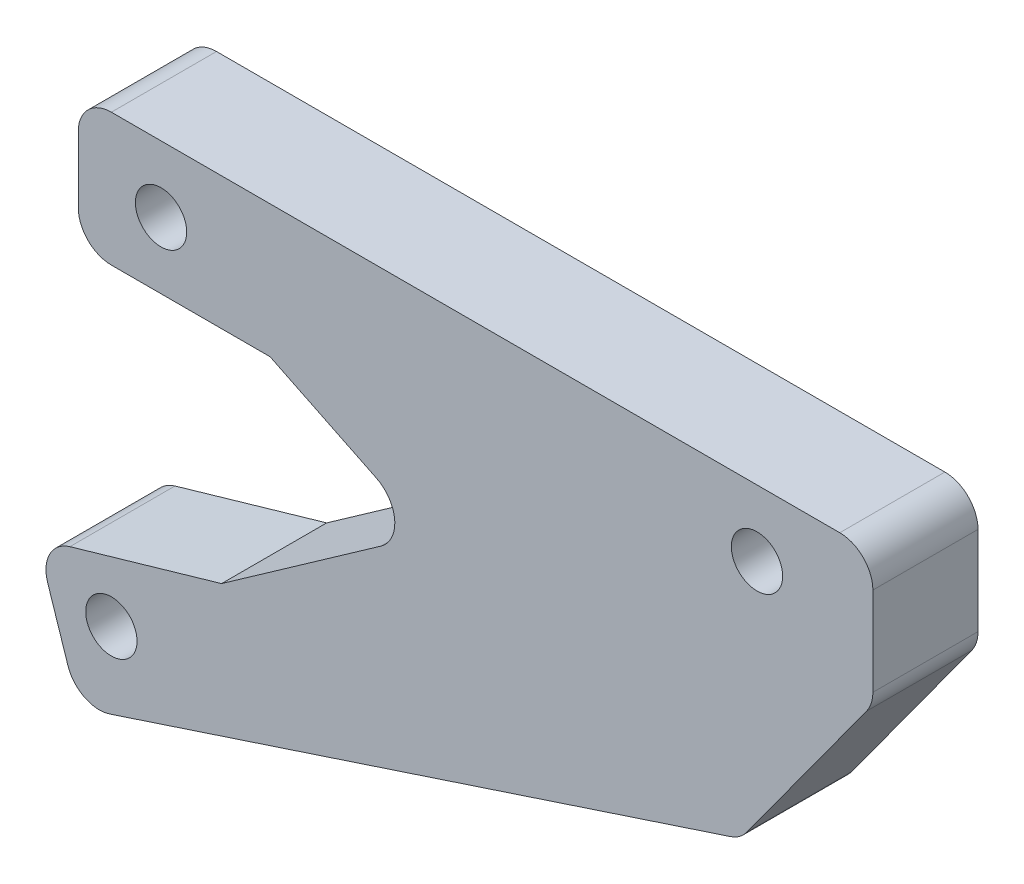
from build123d import *

# Parameters (mm, degrees)
BOSS_EXTRUDE1_DEPTH     = 6.35
CUT_EXTRUDE3_DEPTH      = 40.185503571
CUT_EXTRUDE3_DEPTH_BACK = 40.185503571
SKETCH2_R               = 1.55
BOSS_EXTRUDE2_DEPTH     = 6.35
FILLET1_R               = 2


with BuildPart() as part:
    # Sketch1 → Boss-Extrude1 (new body)
    with BuildSketch(Plane.XY):
        Polygon((24, -4), (16, -15), (-24, -28.159033899), (-26.5, -20.559691822), (10, -10), (14, -4), (-24, -4), (-24, 4), (24, 4), align=None)
    extrude(amount=BOSS_EXTRUDE1_DEPTH)

    # Sketch2 → Cut-Extrude3 (cut, two sides: drawn at the far end of the back side and taken through both)
    with BuildSketch(Plane.XY.offset(-CUT_EXTRUDE3_DEPTH_BACK)):
        with Locations((-19, 0)):
            Circle(SKETCH2_R)
        with Locations((17, 0)):
            Circle(SKETCH2_R)
        with Locations((-22, -22.901341131)):
            Circle(SKETCH2_R)
    extrude(amount=CUT_EXTRUDE3_DEPTH + CUT_EXTRUDE3_DEPTH_BACK, mode=Mode.SUBTRACT)

    # Sketch3 → Boss-Extrude2 (add)
    with BuildSketch(Plane.XY.offset(6.35)):
        Polygon((-12.416374587, -4), (14, -4), (10, -10), (-15.342860583, -17.33185747), (-2.958518174, -8.617728358), align=None)
    extrude(amount=-BOSS_EXTRUDE2_DEPTH)

    # Fillet1
    fillet1_edges = [part.edges().sort_by_distance(p)[0] for p in [
        (24, -4, 3.175),
        (16, -15, 3.175),
        (-24, -28.159033899, 3.175),
        (-26.5, -20.559691822, 3.175),
        (-24, -4, 3.175),
        (-24, 4, 3.175),
        (24, 4, 3.175),
        (-2.958518174, -8.617728358, 3.175),
    ]]
    fillet(fillet1_edges, radius=FILLET1_R)


solid = part.part
